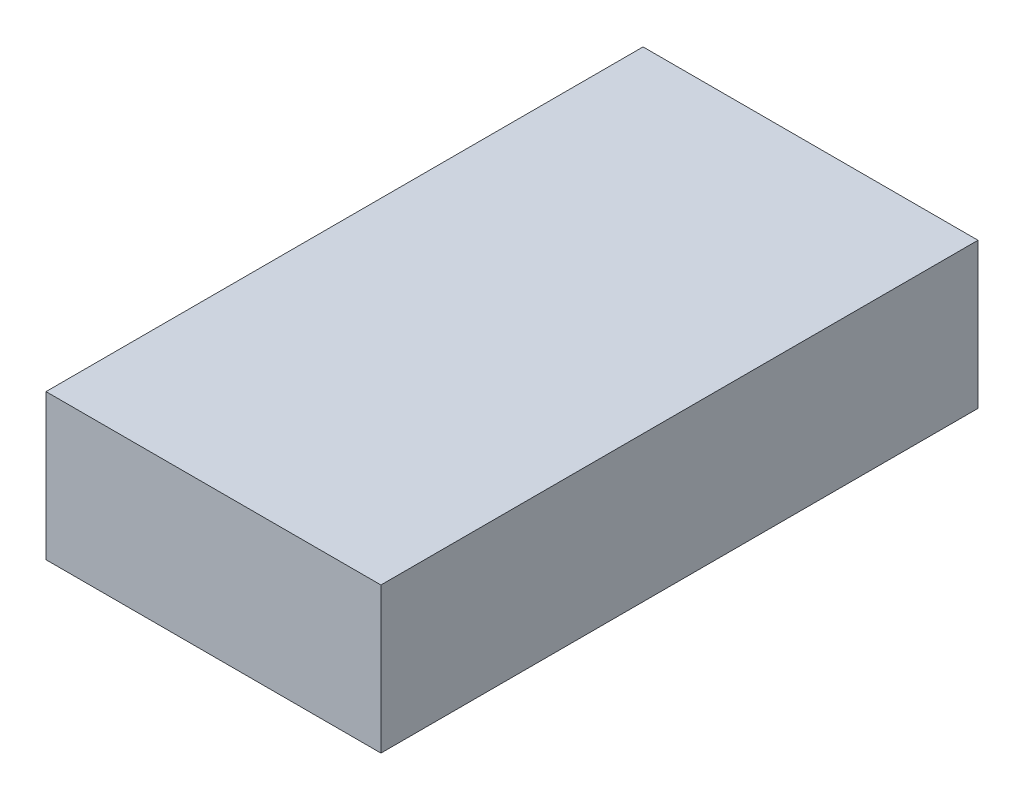
from build123d import *

# Parameters (mm, degrees)
SKETCH1_W           = 115
SKETCH1_H           = 50
BOSS_EXTRUDE1_DEPTH = 205
CUT_EXTRUDE1_DEPTH  = 5


with BuildPart() as part:
    # Sketch1 → Boss-Extrude1 (new body)
    with BuildSketch(Plane.XY):
        with Locations((57.5, 25)):
            Rectangle(SKETCH1_W, SKETCH1_H)
    extrude(amount=BOSS_EXTRUDE1_DEPTH)

    # Sketch2 → Cut-Extrude1 (cut)
    with BuildSketch(Plane.XZ):
        with BuildLine():
            Line((11.75, 179.5), (11.75, 175.5))
            ThreePointArc((11.75, 175.5), (9.75, 173.5), (7.75, 175.5))
            Line((7.75, 175.5), (7.75, 179.5))
            ThreePointArc((7.75, 179.5), (9.75, 181.5), (11.75, 179.5))
        make_face()
        with BuildLine():
            Line((103.25, 179.5), (103.25, 175.5))
            ThreePointArc((103.25, 175.5), (105.25, 173.5), (107.25, 175.5))
            Line((107.25, 175.5), (107.25, 179.5))
            ThreePointArc((107.25, 179.5), (105.25, 181.5), (103.25, 179.5))
        make_face()
        with BuildLine():
            Line((11.75, 7.5), (11.75, 11.5))
            ThreePointArc((11.75, 11.5), (9.75, 13.5), (7.75, 11.5))
            Line((7.75, 11.5), (7.75, 7.5))
            ThreePointArc((7.75, 7.5), (9.75, 5.5), (11.75, 7.5))
        make_face()
        with BuildLine():
            Line((103.25, 7.5), (103.25, 11.5))
            ThreePointArc((103.25, 11.5), (105.25, 13.5), (107.25, 11.5))
            Line((107.25, 11.5), (107.25, 7.5))
            ThreePointArc((107.25, 7.5), (105.25, 5.5), (103.25, 7.5))
        make_face()
    extrude(amount=-CUT_EXTRUDE1_DEPTH, mode=Mode.SUBTRACT)


solid = part.part
